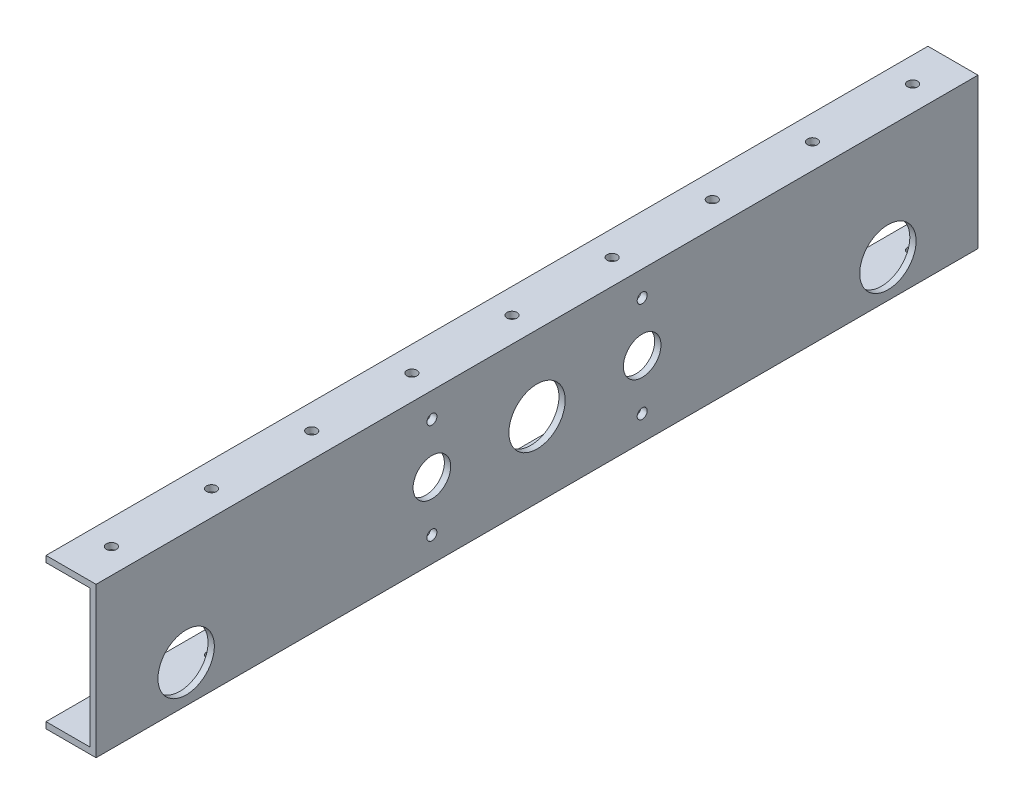
from build123d import *

# Parameters (mm, degrees)
BOSS_EXTRUDE1_START = -342.9
SKETCH4_R           = 2.54
SKETCH4_R_2         = 14.2875
SKETCH4_R_3         = 9.525
BOSS_EXTRUDE1_DEPTH = 3.175
BOSS_EXTRUDE2_DEPTH = 3.175
BOSS_EXTRUDE3_START = -76.2
BOSS_EXTRUDE3_DEPTH = 3.175
SKETCH9_R           = 2.54
CUT_EXTRUDE2_DEPTH  = 523.969471233
LPATTERN1_COUNT     = 10
LPATTERN1_PITCH     = 50.8
SKETCH13_W          = 25.4
SKETCH13_H          = 139.7
CUT_EXTRUDE4_DEPTH  = 523.969471233


with BuildPart() as part:
    # Sketch4 → Boss-Extrude1 (new body)
    with BuildSketch(Plane(origin=(0, 0, 0), x_dir=(0, 0, -1), z_dir=(1, 0, 0)).offset(BOSS_EXTRUDE1_START)):
        with BuildLine():
            Line((363.380981673, 114.3), (0, 114.3))
            Line((0, 114.3), (0, 90.4875))
            ThreePointArc((0, 90.4875), (14.2875, 76.2), (0, 61.9125))
            Line((0, 61.9125), (0, 38.1))
            Line((0, 38.1), (363.380981673, 38.1))
            Line((363.380981673, 38.1), (363.380981673, 114.3))
        make_face()
        with Locations((53.34, 50.8)):
            Circle(SKETCH4_R, mode=Mode.SUBTRACT)
        with Locations((177.987401789, 57.15)):
            Circle(SKETCH4_R_2, mode=Mode.SUBTRACT)
        with Locations((53.34, 76.2)):
            Circle(SKETCH4_R_3, mode=Mode.SUBTRACT)
        with Locations((337.980981673, 60.325)):
            Circle(SKETCH4_R_2, mode=Mode.SUBTRACT)
        with Locations((53.34, 101.6)):
            Circle(SKETCH4_R, mode=Mode.SUBTRACT)
    extrude(amount=-BOSS_EXTRUDE1_DEPTH)

    # Sketch7 → Boss-Extrude2 (add)
    with BuildSketch(Plane(origin=(0, 114.3, 0), x_dir=(1, 0, 0), z_dir=(0, 1, 0))):
        Polygon((-344.4875, 0), (-368.3, 0), (-368.3, 363.380981673), (-342.9, 363.380981673), align=None)
    extrude(amount=-BOSS_EXTRUDE2_DEPTH)

    # Sketch7<2> → Boss-Extrude3 (add)
    with BuildSketch(Plane(origin=(0, 114.3, 0), x_dir=(1, 0, 0), z_dir=(0, 1, 0)).offset(BOSS_EXTRUDE3_START)):
        Polygon((-344.4875, 0), (-368.3, 0), (-368.3, 363.380981673), (-342.9, 363.380981673), align=None)
    extrude(amount=BOSS_EXTRUDE3_DEPTH)

    # Sketch9 → Cut-Extrude2 (cut, through all)
    with BuildSketch(Plane(origin=(0, 114.3, 0), x_dir=(1, 0, 0), z_dir=(0, 1, 0))):
        with Locations(Location((-355.6, 355.6, 0), (0, 0, 270))):
            Circle(SKETCH9_R)
    cut_extrude2 = extrude(amount=-CUT_EXTRUDE2_DEPTH, mode=Mode.SUBTRACT)

    # LPattern1: Cut-Extrude2 ×10
    with Locations(*[(0, 0, i * LPATTERN1_PITCH) for i in range(1, LPATTERN1_COUNT)]):
        add(cut_extrude2, mode=Mode.SUBTRACT)

    # Mirror1: part across face


with BuildPart() as part_1:
    add(part.part)
    add(part.part.mirror(Plane(origin=(-345.639664948, 104.734085052, 0), x_dir=(1, 0, 0), z_dir=(0, 0, 1))))

    # Sketch13 → Cut-Extrude4 (cut, through all)
    with BuildSketch(Plane(origin=(0, 114.3, 0), x_dir=(1, 0, 0), z_dir=(0, 1, 0))):
        with Locations((-355.6, 293.530981673)):
            Rectangle(SKETCH13_W, SKETCH13_H)
        with Locations((-355.6, -293.530981673)):
            Rectangle(SKETCH13_W, SKETCH13_H)
    extrude(amount=-CUT_EXTRUDE4_DEPTH, mode=Mode.SUBTRACT)


solid = part_1.part
